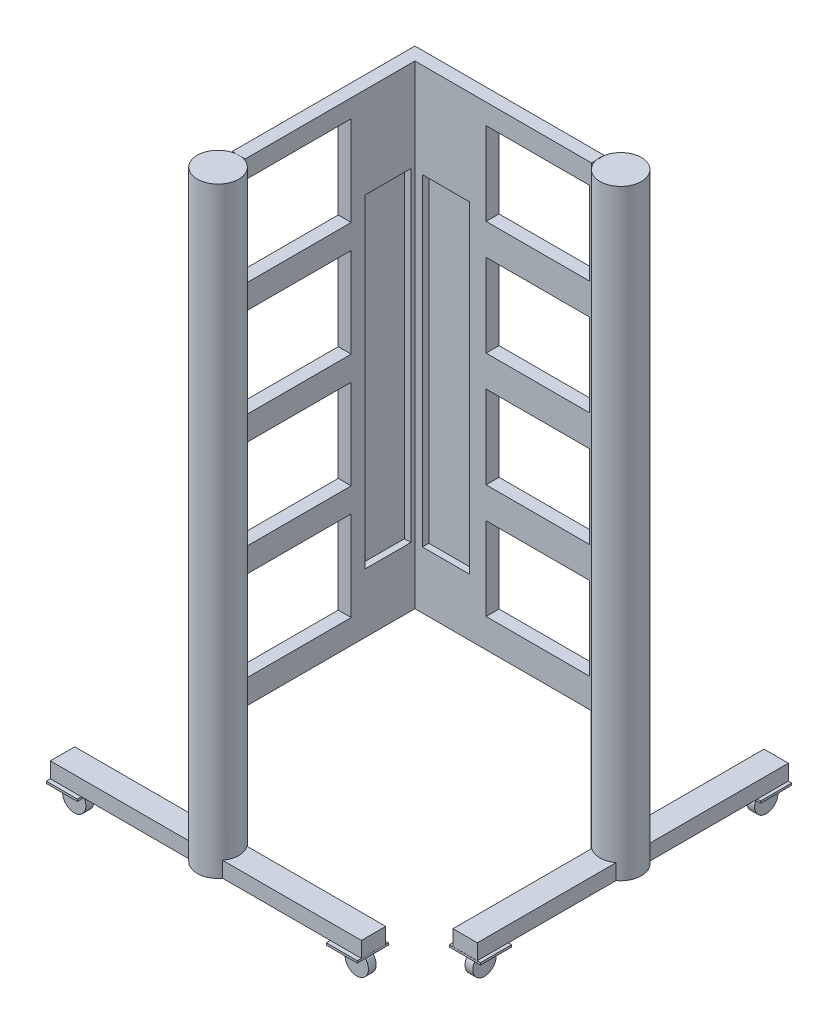
from build123d import *

# Parameters (mm, degrees)
SALIENTE_EXTRUIR1_DEPTH        = 1160
SALIENTE_EXTRUIR1_2_DEPTH      = 1160
SALIENTE_EXTRUIR1_3_DEPTH      = 1160
CROQUIS2_W                     = 204.601269718
CROQUIS2_H                     = 173.253526092
CORTAR_EXTRUIR1_DEPTH          = 150
MATRIZL1_COUNT                 = 5
MATRIZL1_PITCH                 = 220
CROQUIS3_W                     = 88.493917932
CROQUIS3_H                     = 624.678517467
CORTAR_EXTRUIR3_DEPTH          = 150
CROQUIS4_W                     = 91.178394865
CROQUIS4_H                     = 622.095660422
CORTAR_EXTRUIR4_DEPTH          = 150
CROQUIS5_W                     = 352.5
CROQUIS5_H                     = 244.920139752
CORTAR_EXTRUIR5_DEPTH          = 365
CROQUIS6_W                     = 199.035720847
CROQUIS6_H                     = 160
CORTAR_EXTRUIR6_DEPTH          = 365
MATRIZL2_COUNT                 = 4
MATRIZL2_PITCH                 = 220
CROQUIS7_W                     = 91.178394865
CROQUIS7_H                     = 622.095660422
SALIENTE_EXTRUIR2_DEPTH        = 1
CROQUIS8_W                     = 88.493917932
CROQUIS8_H                     = 624.678517467
SALIENTE_EXTRUIR3_DEPTH        = 1
CROQUIS9_W                     = 47
CROQUIS9_H                     = 600
CROQUIS9_W_2                   = 600
CROQUIS9_H_2                   = 47
SALIENTE_EXTRUIR4_DEPTH        = 30
CROQUIS10_W                    = 60
CROQUIS10_H                    = 60
SALIENTE_EXTRUIR5_DEPTH        = 4
SALIENTE_EXTRUIR6_DEPTH        = 7.5
SALIENTE_EXTRUIR6_DEPTH_BACK   = 7.5
CROQUIS11_R                    = 22.5
SALIENTE_EXTRUIR6_2_DEPTH      = 7.5
SALIENTE_EXTRUIR6_2_DEPTH_BACK = 7.5
SALIENTE_EXTRUIR7_DEPTH        = 7.5
SALIENTE_EXTRUIR7_DEPTH_BACK   = 7.5
CROQUIS12_R                    = 22.5
SALIENTE_EXTRUIR7_2_DEPTH      = 7.5
SALIENTE_EXTRUIR7_2_DEPTH_BACK = 7.5


with BuildPart() as part:
    # Croquis1 → Saliente-Extruir1 (new body)
    with BuildSketch(Plane(origin=(0, 0, 0), x_dir=(1, 0, 0), z_dir=(0, 1, 0))):
        with BuildLine():
            Line((0, -340), (0, -12.5))
            Line((0, -12.5), (340.50692706, -12.5))
            Line((340.50692706, -12.5), (340.50692706, -3.20178703))
            ThreePointArc((340.50692706, -3.20178703), (340.221015416, -1.606030904), (340, 0))
            ThreePointArc((340, 0), (339.761756236, 6.269940779), (340.50692706, 12.5))
            Line((340.50692706, 12.5), (-25, 12.5))
            Line((-25, 12.5), (-25, -340))
            Line((-25, -340), (-16.782024574, -340))
            ThreePointArc((-16.782024574, -340), (-12.5, -339.770142891), (-8.217975426, -340))
            Line((-8.217975426, -340), (0, -340))
        make_face()
    extrude(amount=SALIENTE_EXTRUIR1_DEPTH)

    # Croquis2 → Cortar-Extruir1 (cut)
    with BuildSketch(Plane.ZY.offset(25)):
        with Locations((237.699365141, 1038.293376706)):
            Rectangle(CROQUIS2_W, CROQUIS2_H)
    cortar_extruir1 = extrude(amount=-CORTAR_EXTRUIR1_DEPTH, mode=Mode.SUBTRACT)

    # MatrizL1: Cortar-Extruir1 ×5
    with Locations(*[(0, -i * MATRIZL1_PITCH, 0) for i in range(1, MATRIZL1_COUNT)]):
        add(cortar_extruir1, mode=Mode.SUBTRACT)

    # Croquis3 → Cortar-Extruir3 (cut)
    with BuildSketch(Plane.ZY.offset(25)):
        with Locations((64.518154315, 671.862661026)):
            Rectangle(CROQUIS3_W, CROQUIS3_H)
    extrude(amount=-CORTAR_EXTRUIR3_DEPTH, mode=Mode.SUBTRACT)

    # Croquis4 → Cortar-Extruir4 (cut)
    with BuildSketch(Plane(origin=(0, 0, -12.5), x_dir=(-1, 0, 0), z_dir=(0, 0, -1))):
        with Locations((-59.953539945, 666.353095055)):
            Rectangle(CROQUIS4_W, CROQUIS4_H)
    extrude(amount=-CORTAR_EXTRUIR4_DEPTH, mode=Mode.SUBTRACT)

    # Croquis5 → Cortar-Extruir5 (cut)
    with BuildSketch(Plane.ZY.offset(25)):
        with Locations((163.75, 122.460069876)):
            Rectangle(CROQUIS5_W, CROQUIS5_H)
    extrude(amount=-CORTAR_EXTRUIR5_DEPTH, mode=Mode.SUBTRACT)

    # Croquis6 → Cortar-Extruir6 (cut)
    with BuildSketch(Plane(origin=(0, 0, -12.5), x_dir=(-1, 0, 0), z_dir=(0, 0, -1))):
        with Locations((-236.788797545, 1040.641633994)):
            Rectangle(CROQUIS6_W, CROQUIS6_H)
    cortar_extruir6 = extrude(amount=-CORTAR_EXTRUIR6_DEPTH, mode=Mode.SUBTRACT)

    # MatrizL2: Cortar-Extruir6 ×4
    with Locations(*[(0, -i * MATRIZL2_PITCH, 0) for i in range(1, MATRIZL2_COUNT)]):
        add(cortar_extruir6, mode=Mode.SUBTRACT)

    # Croquis7 → Saliente-Extruir2 (add)
    with BuildSketch(Plane(origin=(0, 0, 0), x_dir=(-1, 0, 0), z_dir=(0, 0, -1))):
        with Locations((-59.953539945, 666.353095055)):
            Rectangle(CROQUIS7_W, CROQUIS7_H)
    extrude(amount=SALIENTE_EXTRUIR2_DEPTH)

    # Croquis8 → Saliente-Extruir3 (add)
    with BuildSketch(Plane.ZY.offset(12.5)):
        with Locations((64.518154315, 671.862661026)):
            Rectangle(CROQUIS8_W, CROQUIS8_H)
    extrude(amount=SALIENTE_EXTRUIR3_DEPTH)


with BuildPart() as body_2:
    # Croquis1 → Saliente-Extruir1 2 (new body)
    with BuildSketch(Plane(origin=(0, 0, 0), x_dir=(1, 0, 0), z_dir=(0, 1, 0))):
        with BuildLine():
            Line((340.50692706, 12.5), (340.50692706, -3.20178703))
            ThreePointArc((340.50692706, -3.20178703), (419.728903948, 4.649106485), (340.50692706, 12.5))
        make_face()
    extrude(amount=SALIENTE_EXTRUIR1_2_DEPTH)



with BuildPart() as body_3:
    # Croquis1 → Saliente-Extruir1 3 (new body)
    with BuildSketch(Plane(origin=(0, 0, 0), x_dir=(1, 0, 0), z_dir=(0, 1, 0))):
        with BuildLine():
            ThreePointArc((-16.782024574, -340), (-12.5, -419.770142891), (-8.217975426, -340))
            Line((-8.217975426, -340), (-16.782024574, -340))
        make_face()
    extrude(amount=SALIENTE_EXTRUIR1_3_DEPTH)


with BuildPart() as body_2_1:
    add(body_2.part)

    add(body_3.part)  # Saliente-Extruir4 merges body 3
    # Croquis9 → Saliente-Extruir4 (add)
    with BuildSketch(Plane.XZ):
        with Locations((379.728903948, -4.649106485)):
            Rectangle(CROQUIS9_W, CROQUIS9_H)
        with Locations((-12.5, 379.770142891)):
            Rectangle(CROQUIS9_W_2, CROQUIS9_H_2)
    extrude(amount=-SALIENTE_EXTRUIR4_DEPTH)

    # Croquis10 → Saliente-Extruir5 (add)
    with BuildSketch(Plane.XZ):
        with Locations((257.527448142, 381.045288358)):
            Rectangle(CROQUIS10_W, CROQUIS10_H)
        with Locations((-282.527448142, 381.045288358)):
            Rectangle(CROQUIS10_W, CROQUIS10_H)
        with Locations((379.48572828, 265.545919849)):
            Rectangle(CROQUIS10_W, CROQUIS10_H)
        with Locations((379.48572828, -274.844132819)):
            Rectangle(CROQUIS10_W, CROQUIS10_H)
    extrude(amount=SALIENTE_EXTRUIR5_DEPTH)


with BuildPart() as body_3_2:
    # Croquis11 → Saliente-Extruir6 (new, two sides: drawn at the far end of the back side and taken through both)
    with BuildSketch(Plane(origin=(0, 0, 379.770142891), x_dir=(-1, 0, 0), z_dir=(0, 0, -1)).offset(-SALIENTE_EXTRUIR6_DEPTH_BACK)):
        with Locations((282.364653356, -27.384163756)):
            Circle(CROQUIS11_R)
    extrude(amount=SALIENTE_EXTRUIR6_DEPTH + SALIENTE_EXTRUIR6_DEPTH_BACK)


with BuildPart() as body_4:
    # Croquis11 → Saliente-Extruir6 2 (new, two sides: drawn at the far end of the back side and taken through both)
    with BuildSketch(Plane(origin=(0, 0, 379.770142891), x_dir=(-1, 0, 0), z_dir=(0, 0, -1)).offset(-SALIENTE_EXTRUIR6_2_DEPTH_BACK)):
        with Locations((-262.576426654, -27.384163756)):
            Circle(CROQUIS11_R)
    extrude(amount=SALIENTE_EXTRUIR6_2_DEPTH + SALIENTE_EXTRUIR6_2_DEPTH_BACK)


with BuildPart() as body_5:
    # Croquis12 → Saliente-Extruir7 (new, two sides: drawn at the far end of the back side and taken through both)
    with BuildSketch(Plane(origin=(379.728903948, 0, 0), x_dir=(0, 0, -1), z_dir=(1, 0, 0)).offset(-SALIENTE_EXTRUIR7_DEPTH_BACK)):
        with Locations((-265.545919849, -26.659325153)):
            Circle(CROQUIS12_R)
    extrude(amount=SALIENTE_EXTRUIR7_DEPTH + SALIENTE_EXTRUIR7_DEPTH_BACK)


with BuildPart() as body_6:
    # Croquis12 → Saliente-Extruir7 2 (new, two sides: drawn at the far end of the back side and taken through both)
    with BuildSketch(Plane(origin=(379.728903948, 0, 0), x_dir=(0, 0, -1), z_dir=(1, 0, 0)).offset(-SALIENTE_EXTRUIR7_2_DEPTH_BACK)):
        with Locations((278.01297899, -26.659325153)):
            Circle(CROQUIS12_R)
    extrude(amount=SALIENTE_EXTRUIR7_2_DEPTH + SALIENTE_EXTRUIR7_2_DEPTH_BACK)


solid = Compound([part.part, body_2_1.part, body_3_2.part, body_4.part, body_5.part, body_6.part])
